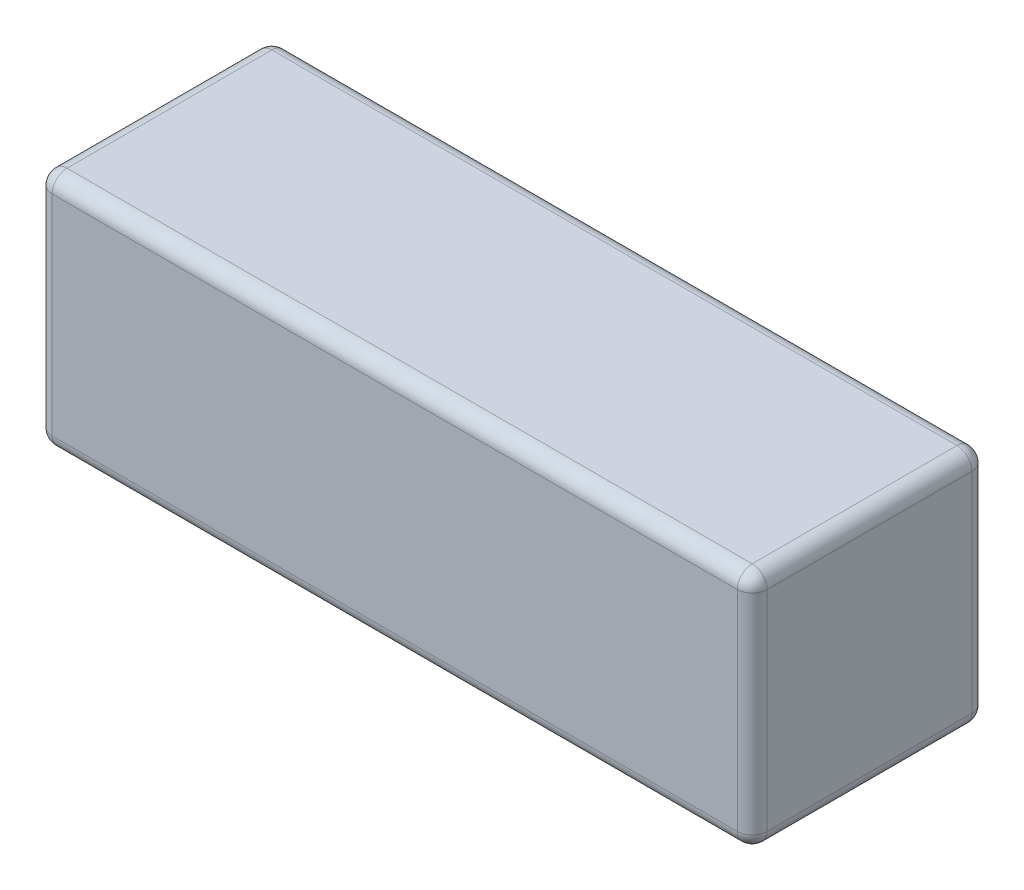
from build123d import *

# Parameters (mm, degrees)
SKETCH1_W           = 152.4
SKETCH1_H           = 50
BOSS_EXTRUDE1_DEPTH = 51
FILLET1_R           = 3.175


with BuildPart() as part:
    # Sketch1 → Boss-Extrude1 (new body)
    with BuildSketch(Plane(origin=(0, 0, 0), x_dir=(1, 0, 0), z_dir=(0, 1, 0))):
        Rectangle(SKETCH1_W, SKETCH1_H)
    extrude(amount=BOSS_EXTRUDE1_DEPTH)

    # Fillet1
    fillet1_edges = [part.edges().sort_by_distance(p)[0] for p in [
        (76.2, 51, 0),
        (0, 51, -25),
        (-76.2, 51, 0),
        (0, 0, -25),
        (76.2, 0, 0),
        (0, 0, 25),
        (-76.2, 0, 0),
        (0, 51, 25),
        (-76.2, 25.5, -25),
        (76.2, 25.5, -25),
        (76.2, 25.5, 25),
        (-76.2, 25.5, 25),
    ]]
    fillet(fillet1_edges, radius=FILLET1_R)


solid = part.part
